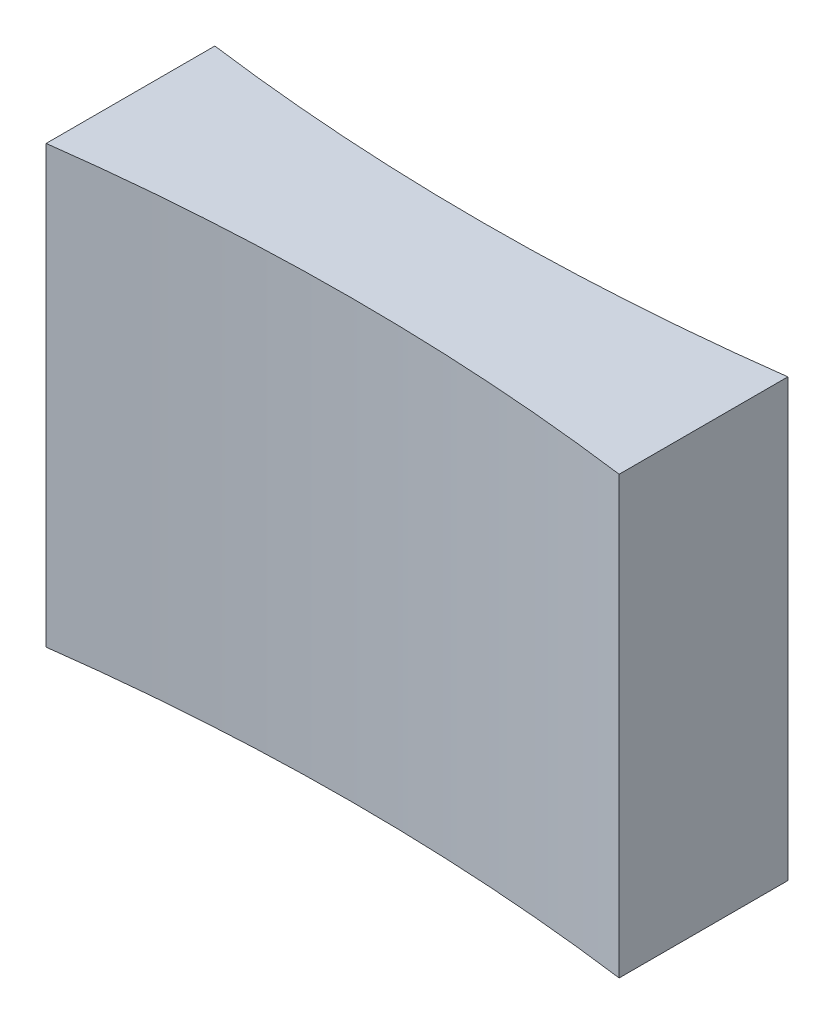
from build123d import *

# Parameters (mm, degrees)
BOSS_EXTRUDE1_DEPTH = 9
BOSS_EXTRUDE2_DEPTH = 11
SKETCH4_W           = 15
SKETCH4_H           = 5
CUT_EXTRUDE1_DEPTH  = 3


with BuildPart() as part:
    # Sketch2 → Boss-Extrude1 (new body)
    with BuildSketch(Plane(origin=(0, 0, 0), x_dir=(1, 0, 0), z_dir=(0, 1, 0))):
        with BuildLine():
            ThreePointArc((-13.134406493, 3.867125393), (0, 3), (13.134406493, 3.867125393))
            Line((13.134406493, 3.867125393), (13.134406493, -3.867125393))
            ThreePointArc((13.134406493, -3.867125393), (0, -3), (-13.134406493, -3.867125393))
            Line((-13.134406493, -3.867125393), (-13.134406493, 3.867125393))
        make_face()
    extrude(amount=BOSS_EXTRUDE1_DEPTH)

    # Sketch3 → Boss-Extrude2 (add)
    with BuildSketch(Plane(origin=(0, 9, 0), x_dir=(1, 0, 0), z_dir=(0, 1, 0))):
        with BuildLine():
            Line((13.134406493, -3.867125393), (13.134406493, 3.867125393))
            ThreePointArc((13.134406493, 3.867125393), (0, 3), (-13.134406493, 3.867125393))
            Line((-13.134406493, 3.867125393), (-13.134406493, -3.867125393))
            ThreePointArc((-13.134406493, -3.867125393), (0, -3), (13.134406493, -3.867125393))
        make_face()
    extrude(amount=BOSS_EXTRUDE2_DEPTH)

    # Sketch4 → Cut-Extrude1 (cut)
    with BuildSketch(Plane.XZ):
        Rectangle(SKETCH4_W, SKETCH4_H)
    extrude(amount=-CUT_EXTRUDE1_DEPTH, mode=Mode.SUBTRACT)


solid = part.part
